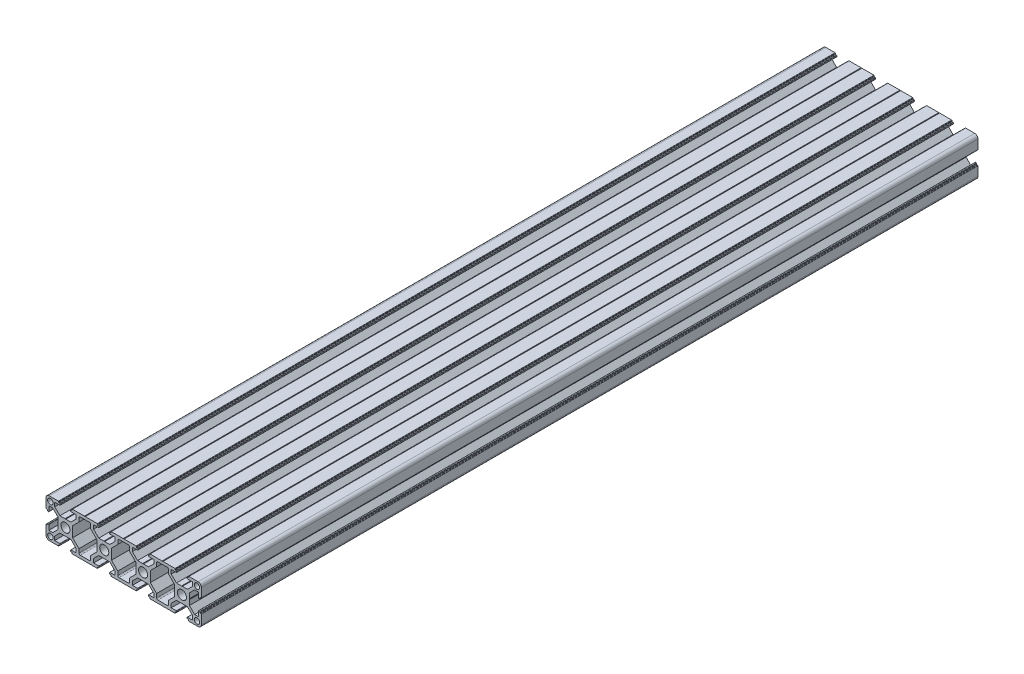
from build123d import *

# Parameters (mm, degrees)
SKETCH_1_R      = 3.5
SKETCH_1_R_2    = 2.1
EXTRUDE_1_DEPTH = 600


with BuildPart() as part:
    # Эскиз1 → Бобышка-Вытянуть1 (new body)
    with BuildSketch(Plane(origin=(0, 600, 0), x_dir=(1, 0, 0), z_dir=(0, 0, -1))):
        with BuildLine():
            Line((-57.5, -15), (-50.4, -15))
            ThreePointArc((-50.4, -15), (-50.258578644, -14.941421356), (-50.2, -14.8))
            Line((-50.2, -14.8), (-50.2, -14.2))
            ThreePointArc((-50.2, -14.2), (-50.141421356, -14.058578644), (-50, -14))
            Line((-50, -14), (-49.3, -14))
            ThreePointArc((-49.3, -14), (-49.158578644, -13.941421356), (-49.1, -13.8))
            Line((-49.1, -13.8), (-49.1, -13))
            ThreePointArc((-49.1, -13), (-49.158578644, -12.858578644), (-49.3, -12.8))
            Line((-49.3, -12.8), (-53.25, -12.8))
            Line((-53.25, -12.8), (-53.25, -9.805634919))
            Line((-53.25, -9.805634919), (-49.244365081, -5.8))
            Line((-49.244365081, -5.8), (-45.337695265, -5.8))
            ThreePointArc((-45.337695265, -5.8), (-45.254943529, -5.78590708), (-45.181521503, -5.745217202))
            Line((-45.181521503, -5.745217202), (-45, -5.6))
            Line((-45, -5.6), (-44.818478497, -5.745217202))
            ThreePointArc((-44.818478497, -5.745217202), (-44.745056471, -5.78590708), (-44.662304735, -5.8))
            Line((-44.662304735, -5.8), (-40.755634919, -5.8))
            Line((-40.755634919, -5.8), (-36.75, -9.805634919))
            Line((-36.75, -9.805634919), (-36.75, -12.8))
            Line((-36.75, -12.8), (-40.7, -12.8))
            ThreePointArc((-40.7, -12.8), (-40.841421356, -12.858578644), (-40.9, -13))
            Line((-40.9, -13), (-40.9, -13.8))
            ThreePointArc((-40.9, -13.8), (-40.841421356, -13.941421356), (-40.7, -14))
            Line((-40.7, -14), (-40, -14))
            ThreePointArc((-40, -14), (-39.858578644, -14.058578644), (-39.8, -14.2))
            Line((-39.8, -14.2), (-39.8, -14.8))
            ThreePointArc((-39.8, -14.8), (-39.741421356, -14.941421356), (-39.6, -15))
            Line((-39.6, -15), (-30.337695265, -15))
            ThreePointArc((-30.337695265, -15), (-30.254943529, -14.98590708), (-30.181521503, -14.945217202))
            Line((-30.181521503, -14.945217202), (-30, -14.8))
            Line((-30, -14.8), (-29.818478497, -14.945217202))
            ThreePointArc((-29.818478497, -14.945217202), (-29.745056471, -14.98590708), (-29.662304735, -15))
            Line((-29.662304735, -15), (-20.4, -15))
            ThreePointArc((-20.4, -15), (-20.258578644, -14.941421356), (-20.2, -14.8))
            Line((-20.2, -14.8), (-20.2, -14.2))
            ThreePointArc((-20.2, -14.2), (-20.141421356, -14.058578644), (-20, -14))
            Line((-20, -14), (-19.3, -14))
            ThreePointArc((-19.3, -14), (-19.158578644, -13.941421356), (-19.1, -13.8))
            Line((-19.1, -13.8), (-19.1, -13))
            ThreePointArc((-19.1, -13), (-19.158578644, -12.858578644), (-19.3, -12.8))
            Line((-19.3, -12.8), (-23.25, -12.8))
            Line((-23.25, -12.8), (-23.25, -9.805634919))
            Line((-23.25, -9.805634919), (-19.244365081, -5.8))
            Line((-19.244365081, -5.8), (-15.337695265, -5.8))
            ThreePointArc((-15.337695265, -5.8), (-15.254943529, -5.78590708), (-15.181521503, -5.745217202))
            Line((-15.181521503, -5.745217202), (-15, -5.6))
            Line((-15, -5.6), (-14.818478497, -5.745217202))
            ThreePointArc((-14.818478497, -5.745217202), (-14.745056471, -5.78590708), (-14.662304735, -5.8))
            Line((-14.662304735, -5.8), (-10.755634919, -5.8))
            Line((-10.755634919, -5.8), (-6.75, -9.805634919))
            Line((-6.75, -9.805634919), (-6.75, -12.8))
            Line((-6.75, -12.8), (-10.7, -12.8))
            ThreePointArc((-10.7, -12.8), (-10.841421356, -12.858578644), (-10.9, -13))
            Line((-10.9, -13), (-10.9, -13.8))
            ThreePointArc((-10.9, -13.8), (-10.841421356, -13.941421356), (-10.7, -14))
            Line((-10.7, -14), (-10, -14))
            ThreePointArc((-10, -14), (-9.858578644, -14.058578644), (-9.8, -14.2))
            Line((-9.8, -14.2), (-9.8, -14.8))
            ThreePointArc((-9.8, -14.8), (-9.741421356, -14.941421356), (-9.6, -15))
            Line((-9.6, -15), (-0.337695265, -15))
            ThreePointArc((-0.337695265, -15), (-0.254943529, -14.98590708), (-0.181521503, -14.945217202))
            Line((-0.181521503, -14.945217202), (0, -14.8))
            Line((0, -14.8), (0.181521503, -14.945217202))
            ThreePointArc((0.181521503, -14.945217202), (0.254943529, -14.98590708), (0.337695265, -15))
            Line((0.337695265, -15), (9.6, -15))
            ThreePointArc((9.6, -15), (9.741421356, -14.941421356), (9.8, -14.8))
            Line((9.8, -14.8), (9.8, -14.2))
            ThreePointArc((9.8, -14.2), (9.858578644, -14.058578644), (10, -14))
            Line((10, -14), (10.7, -14))
            ThreePointArc((10.7, -14), (10.841421356, -13.941421356), (10.9, -13.8))
            Line((10.9, -13.8), (10.9, -13))
            ThreePointArc((10.9, -13), (10.841421356, -12.858578644), (10.7, -12.8))
            Line((10.7, -12.8), (6.75, -12.8))
            Line((6.75, -12.8), (6.75, -9.805634919))
            Line((6.75, -9.805634919), (10.755634919, -5.8))
            Line((10.755634919, -5.8), (14.662304735, -5.8))
            ThreePointArc((14.662304735, -5.8), (14.745056471, -5.78590708), (14.818478497, -5.745217202))
            Line((14.818478497, -5.745217202), (15, -5.6))
            Line((15, -5.6), (15.181521503, -5.745217202))
            ThreePointArc((15.181521503, -5.745217202), (15.254943529, -5.78590708), (15.337695265, -5.8))
            Line((15.337695265, -5.8), (19.244365081, -5.8))
            Line((19.244365081, -5.8), (23.25, -9.805634919))
            Line((23.25, -9.805634919), (23.25, -12.8))
            Line((23.25, -12.8), (19.3, -12.8))
            ThreePointArc((19.3, -12.8), (19.158578644, -12.858578644), (19.1, -13))
            Line((19.1, -13), (19.1, -13.8))
            ThreePointArc((19.1, -13.8), (19.158578644, -13.941421356), (19.3, -14))
            Line((19.3, -14), (20, -14))
            ThreePointArc((20, -14), (20.141421356, -14.058578644), (20.2, -14.2))
            Line((20.2, -14.2), (20.2, -14.8))
            ThreePointArc((20.2, -14.8), (20.258578644, -14.941421356), (20.4, -15))
            Line((20.4, -15), (29.662304735, -15))
            ThreePointArc((29.662304735, -15), (29.745056471, -14.98590708), (29.818478497, -14.945217202))
            Line((29.818478497, -14.945217202), (30, -14.8))
            Line((30, -14.8), (30.181521503, -14.945217202))
            ThreePointArc((30.181521503, -14.945217202), (30.254943529, -14.98590708), (30.337695265, -15))
            Line((30.337695265, -15), (39.6, -15))
            ThreePointArc((39.6, -15), (39.741421356, -14.941421356), (39.8, -14.8))
            Line((39.8, -14.8), (39.8, -14.2))
            ThreePointArc((39.8, -14.2), (39.858578644, -14.058578644), (40, -14))
            Line((40, -14), (40.7, -14))
            ThreePointArc((40.7, -14), (40.841421356, -13.941421356), (40.9, -13.8))
            Line((40.9, -13.8), (40.9, -13))
            ThreePointArc((40.9, -13), (40.841421356, -12.858578644), (40.7, -12.8))
            Line((40.7, -12.8), (36.75, -12.8))
            Line((36.75, -12.8), (36.75, -9.805634919))
            Line((36.75, -9.805634919), (40.755634919, -5.8))
            Line((40.755634919, -5.8), (44.662304735, -5.8))
            ThreePointArc((44.662304735, -5.8), (44.745056471, -5.78590708), (44.818478497, -5.745217202))
            Line((44.818478497, -5.745217202), (45, -5.6))
            Line((45, -5.6), (45.181521503, -5.745217202))
            ThreePointArc((45.181521503, -5.745217202), (45.254943529, -5.78590708), (45.337695265, -5.8))
            Line((45.337695265, -5.8), (49.244365081, -5.8))
            Line((49.244365081, -5.8), (53.25, -9.805634919))
            Line((53.25, -9.805634919), (53.25, -12.8))
            Line((53.25, -12.8), (49.3, -12.8))
            ThreePointArc((49.3, -12.8), (49.158578644, -12.858578644), (49.1, -13))
            Line((49.1, -13), (49.1, -13.8))
            ThreePointArc((49.1, -13.8), (49.158578644, -13.941421356), (49.3, -14))
            Line((49.3, -14), (50, -14))
            ThreePointArc((50, -14), (50.141421356, -14.058578644), (50.2, -14.2))
            Line((50.2, -14.2), (50.2, -14.8))
            ThreePointArc((50.2, -14.8), (50.258578644, -14.941421356), (50.4, -15))
            Line((50.4, -15), (57.5, -15))
            ThreePointArc((57.5, -15), (59.267766953, -14.267766953), (60, -12.5))
            Line((60, -12.5), (60, -5.4))
            ThreePointArc((60, -5.4), (59.941421356, -5.258578644), (59.8, -5.2))
            Line((59.8, -5.2), (59.2, -5.2))
            ThreePointArc((59.2, -5.2), (59.058578644, -5.141421356), (59, -5))
            Line((59, -5), (59, -4.3))
            ThreePointArc((59, -4.3), (58.941421356, -4.158578644), (58.8, -4.1))
            Line((58.8, -4.1), (58, -4.1))
            ThreePointArc((58, -4.1), (57.858578644, -4.158578644), (57.8, -4.3))
            Line((57.8, -4.3), (57.8, -8.25))
            Line((57.8, -8.25), (54.805634919, -8.25))
            Line((54.805634919, -8.25), (50.8, -4.244365081))
            Line((50.8, -4.244365081), (50.8, -0.337695265))
            ThreePointArc((50.8, -0.337695265), (50.78590708, -0.254943529), (50.745217202, -0.181521503))
            Line((50.745217202, -0.181521503), (50.6, 0))
            Line((50.6, 0), (50.745217202, 0.181521503))
            ThreePointArc((50.745217202, 0.181521503), (50.78590708, 0.254943529), (50.8, 0.337695265))
            Line((50.8, 0.337695265), (50.8, 4.244365081))
            Line((50.8, 4.244365081), (54.805634919, 8.25))
            Line((54.805634919, 8.25), (57.8, 8.25))
            Line((57.8, 8.25), (57.8, 4.3))
            ThreePointArc((57.8, 4.3), (57.858578644, 4.158578644), (58, 4.1))
            Line((58, 4.1), (58.8, 4.1))
            ThreePointArc((58.8, 4.1), (58.941421356, 4.158578644), (59, 4.3))
            Line((59, 4.3), (59, 5))
            ThreePointArc((59, 5), (59.058578644, 5.141421356), (59.2, 5.2))
            Line((59.2, 5.2), (59.8, 5.2))
            ThreePointArc((59.8, 5.2), (59.941421356, 5.258578644), (60, 5.4))
            Line((60, 5.4), (60, 12.5))
            ThreePointArc((60, 12.5), (59.267766953, 14.267766953), (57.5, 15))
            Line((57.5, 15), (50.4, 15))
            ThreePointArc((50.4, 15), (50.258578644, 14.941421356), (50.2, 14.8))
            Line((50.2, 14.8), (50.2, 14.2))
            ThreePointArc((50.2, 14.2), (50.141421356, 14.058578644), (50, 14))
            Line((50, 14), (49.3, 14))
            ThreePointArc((49.3, 14), (49.158578644, 13.941421356), (49.1, 13.8))
            Line((49.1, 13.8), (49.1, 13))
            ThreePointArc((49.1, 13), (49.158578644, 12.858578644), (49.3, 12.8))
            Line((49.3, 12.8), (53.25, 12.8))
            Line((53.25, 12.8), (53.25, 9.805634919))
            Line((53.25, 9.805634919), (49.244365081, 5.8))
            Line((49.244365081, 5.8), (45.337695265, 5.8))
            ThreePointArc((45.337695265, 5.8), (45.254943529, 5.78590708), (45.181521503, 5.745217202))
            Line((45.181521503, 5.745217202), (45, 5.6))
            Line((45, 5.6), (44.818478497, 5.745217202))
            ThreePointArc((44.818478497, 5.745217202), (44.745056471, 5.78590708), (44.662304735, 5.8))
            Line((44.662304735, 5.8), (40.755634919, 5.8))
            Line((40.755634919, 5.8), (36.75, 9.805634919))
            Line((36.75, 9.805634919), (36.75, 12.8))
            Line((36.75, 12.8), (40.7, 12.8))
            ThreePointArc((40.7, 12.8), (40.841421356, 12.858578644), (40.9, 13))
            Line((40.9, 13), (40.9, 13.8))
            ThreePointArc((40.9, 13.8), (40.841421356, 13.941421356), (40.7, 14))
            Line((40.7, 14), (40, 14))
            ThreePointArc((40, 14), (39.858578644, 14.058578644), (39.8, 14.2))
            Line((39.8, 14.2), (39.8, 14.8))
            ThreePointArc((39.8, 14.8), (39.741421356, 14.941421356), (39.6, 15))
            Line((39.6, 15), (30.337695265, 15))
            ThreePointArc((30.337695265, 15), (30.254943529, 14.98590708), (30.181521503, 14.945217202))
            Line((30.181521503, 14.945217202), (30, 14.8))
            Line((30, 14.8), (29.818478497, 14.945217202))
            ThreePointArc((29.818478497, 14.945217202), (29.745056471, 14.98590708), (29.662304735, 15))
            Line((29.662304735, 15), (20.4, 15))
            ThreePointArc((20.4, 15), (20.258578644, 14.941421356), (20.2, 14.8))
            Line((20.2, 14.8), (20.2, 14.2))
            ThreePointArc((20.2, 14.2), (20.141421356, 14.058578644), (20, 14))
            Line((20, 14), (19.3, 14))
            ThreePointArc((19.3, 14), (19.158578644, 13.941421356), (19.1, 13.8))
            Line((19.1, 13.8), (19.1, 13))
            ThreePointArc((19.1, 13), (19.158578644, 12.858578644), (19.3, 12.8))
            Line((19.3, 12.8), (23.25, 12.8))
            Line((23.25, 12.8), (23.25, 9.805634919))
            Line((23.25, 9.805634919), (19.244365081, 5.8))
            Line((19.244365081, 5.8), (15.337695265, 5.8))
            ThreePointArc((15.337695265, 5.8), (15.254943529, 5.78590708), (15.181521503, 5.745217202))
            Line((15.181521503, 5.745217202), (15, 5.6))
            Line((15, 5.6), (14.818478497, 5.745217202))
            ThreePointArc((14.818478497, 5.745217202), (14.745056471, 5.78590708), (14.662304735, 5.8))
            Line((14.662304735, 5.8), (10.755634919, 5.8))
            Line((10.755634919, 5.8), (6.75, 9.805634919))
            Line((6.75, 9.805634919), (6.75, 12.8))
            Line((6.75, 12.8), (10.7, 12.8))
            ThreePointArc((10.7, 12.8), (10.841421356, 12.858578644), (10.9, 13))
            Line((10.9, 13), (10.9, 13.8))
            ThreePointArc((10.9, 13.8), (10.841421356, 13.941421356), (10.7, 14))
            Line((10.7, 14), (10, 14))
            ThreePointArc((10, 14), (9.858578644, 14.058578644), (9.8, 14.2))
            Line((9.8, 14.2), (9.8, 14.8))
            ThreePointArc((9.8, 14.8), (9.741421356, 14.941421356), (9.6, 15))
            Line((9.6, 15), (0.337695265, 15))
            ThreePointArc((0.337695265, 15), (0.254943529, 14.98590708), (0.181521503, 14.945217202))
            Line((0.181521503, 14.945217202), (0, 14.8))
            Line((0, 14.8), (-0.181521503, 14.945217202))
            ThreePointArc((-0.181521503, 14.945217202), (-0.254943529, 14.98590708), (-0.337695265, 15))
            Line((-0.337695265, 15), (-9.6, 15))
            ThreePointArc((-9.6, 15), (-9.741421356, 14.941421356), (-9.8, 14.8))
            Line((-9.8, 14.8), (-9.8, 14.2))
            ThreePointArc((-9.8, 14.2), (-9.858578644, 14.058578644), (-10, 14))
            Line((-10, 14), (-10.7, 14))
            ThreePointArc((-10.7, 14), (-10.841421356, 13.941421356), (-10.9, 13.8))
            Line((-10.9, 13.8), (-10.9, 13))
            ThreePointArc((-10.9, 13), (-10.841421356, 12.858578644), (-10.7, 12.8))
            Line((-10.7, 12.8), (-6.75, 12.8))
            Line((-6.75, 12.8), (-6.75, 9.805634919))
            Line((-6.75, 9.805634919), (-10.755634919, 5.8))
            Line((-10.755634919, 5.8), (-14.662304735, 5.8))
            ThreePointArc((-14.662304735, 5.8), (-14.745056471, 5.78590708), (-14.818478497, 5.745217202))
            Line((-14.818478497, 5.745217202), (-15, 5.6))
            Line((-15, 5.6), (-15.181521503, 5.745217202))
            ThreePointArc((-15.181521503, 5.745217202), (-15.254943529, 5.78590708), (-15.337695265, 5.8))
            Line((-15.337695265, 5.8), (-19.244365081, 5.8))
            Line((-19.244365081, 5.8), (-23.25, 9.805634919))
            Line((-23.25, 9.805634919), (-23.25, 12.8))
            Line((-23.25, 12.8), (-19.3, 12.8))
            ThreePointArc((-19.3, 12.8), (-19.158578644, 12.858578644), (-19.1, 13))
            Line((-19.1, 13), (-19.1, 13.8))
            ThreePointArc((-19.1, 13.8), (-19.158578644, 13.941421356), (-19.3, 14))
            Line((-19.3, 14), (-20, 14))
            ThreePointArc((-20, 14), (-20.141421356, 14.058578644), (-20.2, 14.2))
            Line((-20.2, 14.2), (-20.2, 14.8))
            ThreePointArc((-20.2, 14.8), (-20.258578644, 14.941421356), (-20.4, 15))
            Line((-20.4, 15), (-29.662304735, 15))
            ThreePointArc((-29.662304735, 15), (-29.745056471, 14.98590708), (-29.818478497, 14.945217202))
            Line((-29.818478497, 14.945217202), (-30, 14.8))
            Line((-30, 14.8), (-30.181521503, 14.945217202))
            ThreePointArc((-30.181521503, 14.945217202), (-30.254943529, 14.98590708), (-30.337695265, 15))
            Line((-30.337695265, 15), (-39.6, 15))
            ThreePointArc((-39.6, 15), (-39.741421356, 14.941421356), (-39.8, 14.8))
            Line((-39.8, 14.8), (-39.8, 14.2))
            ThreePointArc((-39.8, 14.2), (-39.858578644, 14.058578644), (-40, 14))
            Line((-40, 14), (-40.7, 14))
            ThreePointArc((-40.7, 14), (-40.841421356, 13.941421356), (-40.9, 13.8))
            Line((-40.9, 13.8), (-40.9, 13))
            ThreePointArc((-40.9, 13), (-40.841421356, 12.858578644), (-40.7, 12.8))
            Line((-40.7, 12.8), (-36.75, 12.8))
            Line((-36.75, 12.8), (-36.75, 9.805634919))
            Line((-36.75, 9.805634919), (-40.755634919, 5.8))
            Line((-40.755634919, 5.8), (-44.662304735, 5.8))
            ThreePointArc((-44.662304735, 5.8), (-44.745056471, 5.78590708), (-44.818478497, 5.745217202))
            Line((-44.818478497, 5.745217202), (-45, 5.6))
            Line((-45, 5.6), (-45.181521503, 5.745217202))
            ThreePointArc((-45.181521503, 5.745217202), (-45.254943529, 5.78590708), (-45.337695265, 5.8))
            Line((-45.337695265, 5.8), (-49.244365081, 5.8))
            Line((-49.244365081, 5.8), (-53.25, 9.805634919))
            Line((-53.25, 9.805634919), (-53.25, 12.8))
            Line((-53.25, 12.8), (-49.3, 12.8))
            ThreePointArc((-49.3, 12.8), (-49.158578644, 12.858578644), (-49.1, 13))
            Line((-49.1, 13), (-49.1, 13.8))
            ThreePointArc((-49.1, 13.8), (-49.158578644, 13.941421356), (-49.3, 14))
            Line((-49.3, 14), (-50, 14))
            ThreePointArc((-50, 14), (-50.141421356, 14.058578644), (-50.2, 14.2))
            Line((-50.2, 14.2), (-50.2, 14.8))
            ThreePointArc((-50.2, 14.8), (-50.258578644, 14.941421356), (-50.4, 15))
            Line((-50.4, 15), (-57.5, 15))
            ThreePointArc((-57.5, 15), (-59.267766953, 14.267766953), (-60, 12.5))
            Line((-60, 12.5), (-60, 5.4))
            ThreePointArc((-60, 5.4), (-59.941421356, 5.258578644), (-59.8, 5.2))
            Line((-59.8, 5.2), (-59.2, 5.2))
            ThreePointArc((-59.2, 5.2), (-59.058578644, 5.141421356), (-59, 5))
            Line((-59, 5), (-59, 4.3))
            ThreePointArc((-59, 4.3), (-58.941421356, 4.158578644), (-58.8, 4.1))
            Line((-58.8, 4.1), (-58, 4.1))
            ThreePointArc((-58, 4.1), (-57.858578644, 4.158578644), (-57.8, 4.3))
            Line((-57.8, 4.3), (-57.8, 8.25))
            Line((-57.8, 8.25), (-54.805634919, 8.25))
            Line((-54.805634919, 8.25), (-50.8, 4.244365081))
            Line((-50.8, 4.244365081), (-50.8, 0.337695265))
            ThreePointArc((-50.8, 0.337695265), (-50.78590708, 0.254943529), (-50.745217202, 0.181521503))
            Line((-50.745217202, 0.181521503), (-50.6, 0))
            Line((-50.6, 0), (-50.745217202, -0.181521503))
            ThreePointArc((-50.745217202, -0.181521503), (-50.78590708, -0.254943529), (-50.8, -0.337695265))
            Line((-50.8, -0.337695265), (-50.8, -4.244365081))
            Line((-50.8, -4.244365081), (-54.805634919, -8.25))
            Line((-54.805634919, -8.25), (-57.8, -8.25))
            Line((-57.8, -8.25), (-57.8, -4.3))
            ThreePointArc((-57.8, -4.3), (-57.858578644, -4.158578644), (-58, -4.1))
            Line((-58, -4.1), (-58.8, -4.1))
            ThreePointArc((-58.8, -4.1), (-58.941421356, -4.158578644), (-59, -4.3))
            Line((-59, -4.3), (-59, -5))
            ThreePointArc((-59, -5), (-59.058578644, -5.141421356), (-59.2, -5.2))
            Line((-59.2, -5.2), (-59.8, -5.2))
            ThreePointArc((-59.8, -5.2), (-59.941421356, -5.258578644), (-60, -5.4))
            Line((-60, -5.4), (-60, -12.5))
            ThreePointArc((-60, -12.5), (-59.267766953, -14.267766953), (-57.5, -15))
        make_face()
        with Locations((-15, 0)):
            Circle(SKETCH_1_R, mode=Mode.SUBTRACT)
        with Locations((-56.625, -11.625)):
            Circle(SKETCH_1_R_2, mode=Mode.SUBTRACT)
        with Locations((-56.625, 11.625)):
            Circle(SKETCH_1_R_2, mode=Mode.SUBTRACT)
        with Locations((56.625, -11.625)):
            Circle(SKETCH_1_R_2, mode=Mode.SUBTRACT)
        with Locations((56.625, 11.625)):
            Circle(SKETCH_1_R_2, mode=Mode.SUBTRACT)
        with Locations((-45, 0)):
            Circle(SKETCH_1_R, mode=Mode.SUBTRACT)
        with Locations((15, 0)):
            Circle(SKETCH_1_R, mode=Mode.SUBTRACT)
        with Locations((45, 0)):
            Circle(SKETCH_1_R, mode=Mode.SUBTRACT)
        with BuildLine():
            Line((-25.45, 11.8), (-25.45, 8.894365081))
            Line((-25.45, 8.894365081), (-20.6, 4.044365081))
            Line((-20.6, 4.044365081), (-20.6, -4.044365081))
            Line((-20.6, -4.044365081), (-25.45, -8.894365081))
            Line((-25.45, -8.894365081), (-25.45, -11.8))
            ThreePointArc((-25.45, -11.8), (-25.742893219, -12.507106781), (-26.45, -12.8))
            Line((-26.45, -12.8), (-33.55, -12.8))
            ThreePointArc((-33.55, -12.8), (-34.257106781, -12.507106781), (-34.55, -11.8))
            Line((-34.55, -11.8), (-34.55, -8.894365081))
            Line((-34.55, -8.894365081), (-39.4, -4.044365081))
            Line((-39.4, -4.044365081), (-39.4, 4.044365081))
            Line((-39.4, 4.044365081), (-34.55, 8.894365081))
            Line((-34.55, 8.894365081), (-34.55, 11.8))
            ThreePointArc((-34.55, 11.8), (-34.257106781, 12.507106781), (-33.55, 12.8))
            Line((-33.55, 12.8), (-26.45, 12.8))
            ThreePointArc((-26.45, 12.8), (-25.742893219, 12.507106781), (-25.45, 11.8))
        make_face(mode=Mode.SUBTRACT)
        with BuildLine():
            Line((-4.55, -11.8), (-4.55, -8.894365081))
            Line((-4.55, -8.894365081), (-9.4, -4.044365081))
            Line((-9.4, -4.044365081), (-9.4, 4.044365081))
            Line((-9.4, 4.044365081), (-4.55, 8.894365081))
            Line((-4.55, 8.894365081), (-4.55, 11.8))
            ThreePointArc((-4.55, 11.8), (-4.257106781, 12.507106781), (-3.55, 12.8))
            Line((-3.55, 12.8), (3.55, 12.8))
            ThreePointArc((3.55, 12.8), (4.257106781, 12.507106781), (4.55, 11.8))
            Line((4.55, 11.8), (4.55, 8.894365081))
            Line((4.55, 8.894365081), (9.4, 4.044365081))
            Line((9.4, 4.044365081), (9.4, -4.044365081))
            Line((9.4, -4.044365081), (4.55, -8.894365081))
            Line((4.55, -8.894365081), (4.55, -11.8))
            ThreePointArc((4.55, -11.8), (4.257106781, -12.507106781), (3.55, -12.8))
            Line((3.55, -12.8), (-3.55, -12.8))
            ThreePointArc((-3.55, -12.8), (-4.257106781, -12.507106781), (-4.55, -11.8))
        make_face(mode=Mode.SUBTRACT)
        with BuildLine():
            Line((25.45, -8.894365081), (20.6, -4.044365081))
            Line((20.6, -4.044365081), (20.6, 4.044365081))
            Line((20.6, 4.044365081), (25.45, 8.894365081))
            Line((25.45, 8.894365081), (25.45, 11.8))
            ThreePointArc((25.45, 11.8), (25.742893219, 12.507106781), (26.45, 12.8))
            Line((26.45, 12.8), (33.55, 12.8))
            ThreePointArc((33.55, 12.8), (34.257106781, 12.507106781), (34.55, 11.8))
            Line((34.55, 11.8), (34.55, 8.894365081))
            Line((34.55, 8.894365081), (39.4, 4.044365081))
            Line((39.4, 4.044365081), (39.4, -4.044365081))
            Line((39.4, -4.044365081), (34.55, -8.894365081))
            Line((34.55, -8.894365081), (34.55, -11.8))
            ThreePointArc((34.55, -11.8), (34.257106781, -12.507106781), (33.55, -12.8))
            Line((33.55, -12.8), (26.45, -12.8))
            ThreePointArc((26.45, -12.8), (25.742893219, -12.507106781), (25.45, -11.8))
            Line((25.45, -11.8), (25.45, -8.894365081))
        make_face(mode=Mode.SUBTRACT)
    extrude(amount=-EXTRUDE_1_DEPTH)


solid = part.part
